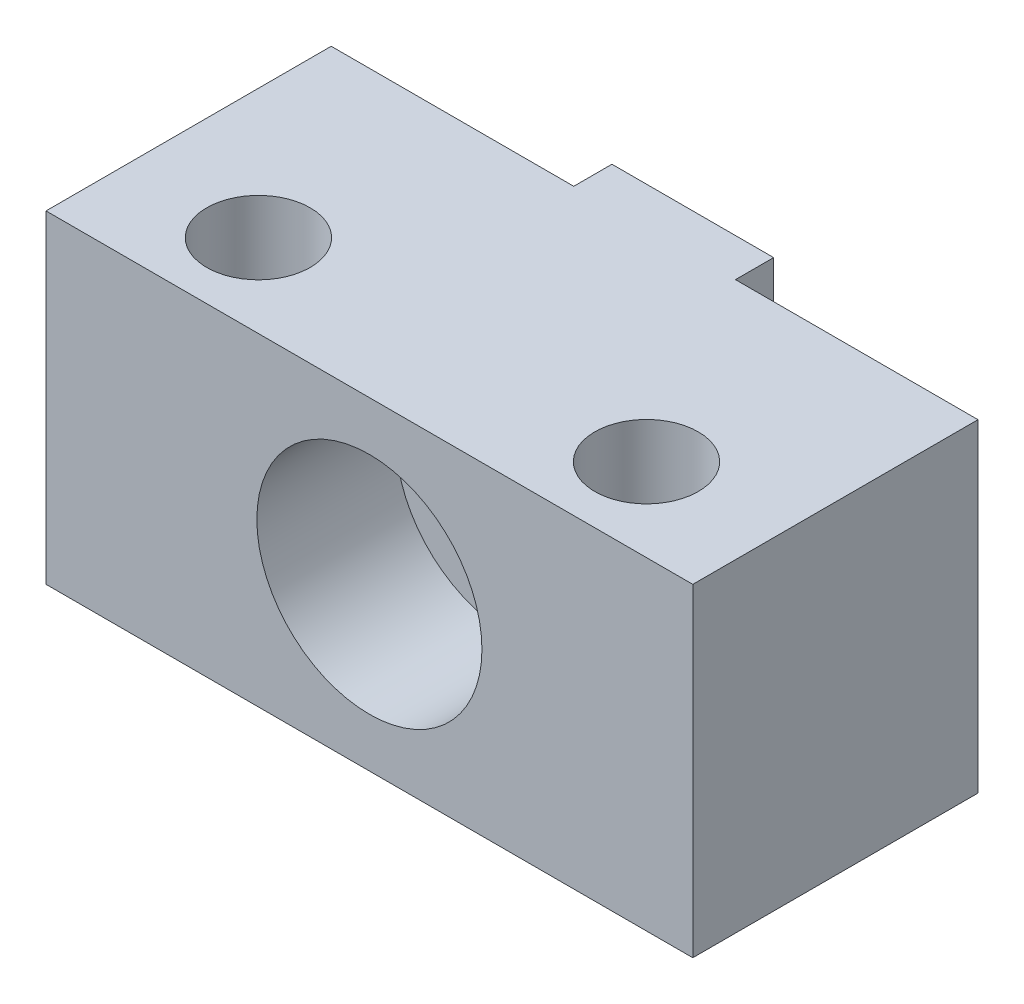
from build123d import *

# Parameters (mm, degrees)
SKETCH1_W                                           = 25.4
SKETCH1_H                                           = 12.7
BOSS_EXTRUDE1_DEPTH                                 = 12.7
SKETCH2_W                                           = 9.525
SKETCH2_H                                           = 1.5
CUT_EXTRUDE1_DEPTH                                  = 22.166482939
SKETCH3_W                                           = 9.525
SKETCH3_H                                           = 1.5
CUT_EXTRUDE2_DEPTH                                  = 22.166482939
F_6_CLEARANCE_HOLE1_D                               = 4.064
CBORE_FOR_10_BINDING_HEAD_MACHINE_SCREW_D           = 5
CBORE_FOR_10_BINDING_HEAD_MACHINE_SCREW_CBORE_D     = 8.8392
CBORE_FOR_10_BINDING_HEAD_MACHINE_SCREW_CBORE_DEPTH = 5.461


with BuildPart() as part:
    # Sketch1 → Boss-Extrude1 (new body)
    with BuildSketch(Plane(origin=(0, 12.7, 0), x_dir=(1, 0, 0), z_dir=(0, 1, 0))):
        with Locations((0, -4.85)):
            Rectangle(SKETCH1_W, SKETCH1_H)
    extrude(amount=-BOSS_EXTRUDE1_DEPTH)

    # Sketch2 → Cut-Extrude1 (cut, through all)
    with BuildSketch(Plane.XZ):
        with Locations((7.9375, -0.75)):
            Rectangle(SKETCH2_W, SKETCH2_H)
    extrude(amount=-CUT_EXTRUDE1_DEPTH, mode=Mode.SUBTRACT)

    # Sketch3 → Cut-Extrude2 (cut, through all)
    with BuildSketch(Plane.XZ):
        with Locations((-7.9375, -0.75)):
            Rectangle(SKETCH3_W, SKETCH3_H)
    extrude(amount=-CUT_EXTRUDE2_DEPTH, mode=Mode.SUBTRACT)

    # #6 Clearance Hole1 (through all)
    with Locations(Plane(origin=(0, 0, 0), x_dir=(-1, 0, 0), z_dir=(0, -1, 0))):
        with Locations((7.62, -7.9375), (-7.62, -7.9375)):
            Hole(F_6_CLEARANCE_HOLE1_D / 2)

    # CBORE for #10 Binding Head Machine Screw1 (through all)
    with Locations(Plane.XY.offset(11.2)):
        with Locations((0, 6.35)):
            CounterBoreHole(CBORE_FOR_10_BINDING_HEAD_MACHINE_SCREW_D / 2, CBORE_FOR_10_BINDING_HEAD_MACHINE_SCREW_CBORE_D / 2, CBORE_FOR_10_BINDING_HEAD_MACHINE_SCREW_CBORE_DEPTH)


solid = part.part
